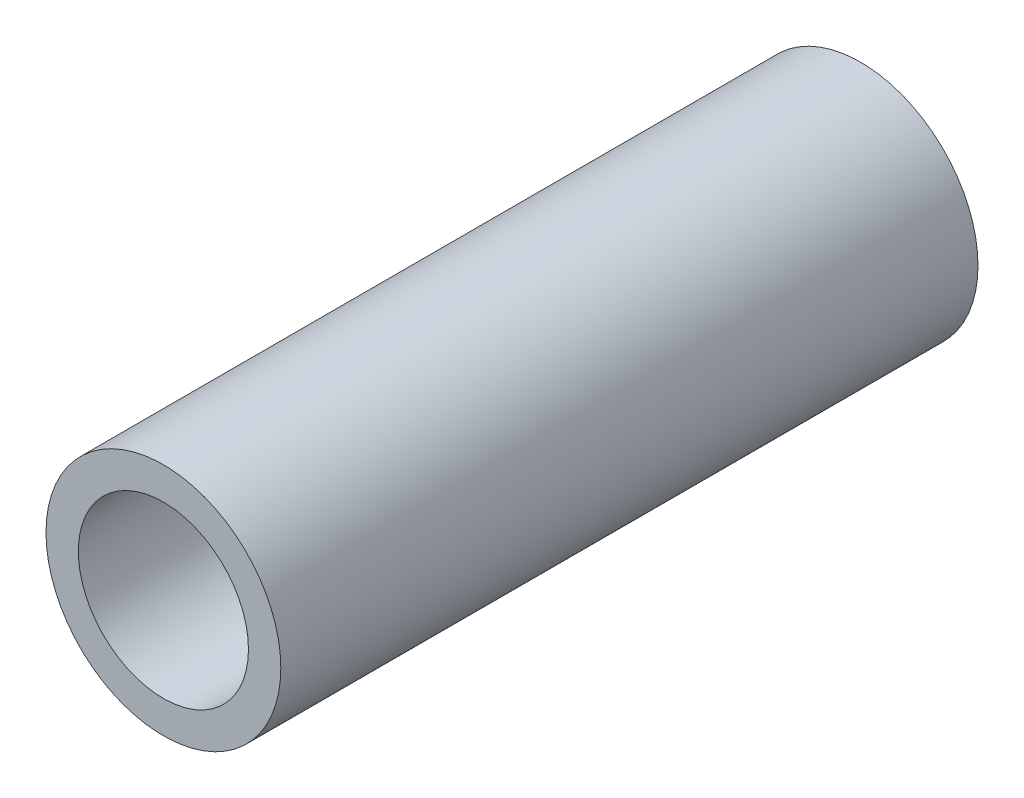
from build123d import *

# Parameters (mm, degrees)
SKETCH1_R           = 10.6934
SKETCH1_R_2         = 7.747
BOSS_EXTRUDE1_DEPTH = 63.5


with BuildPart() as part:
    # Sketch1 → Boss-Extrude1 (new body)
    with BuildSketch(Plane.XY):
        Circle(SKETCH1_R)
        Circle(SKETCH1_R_2, mode=Mode.SUBTRACT)
    extrude(amount=BOSS_EXTRUDE1_DEPTH)


solid = part.part
